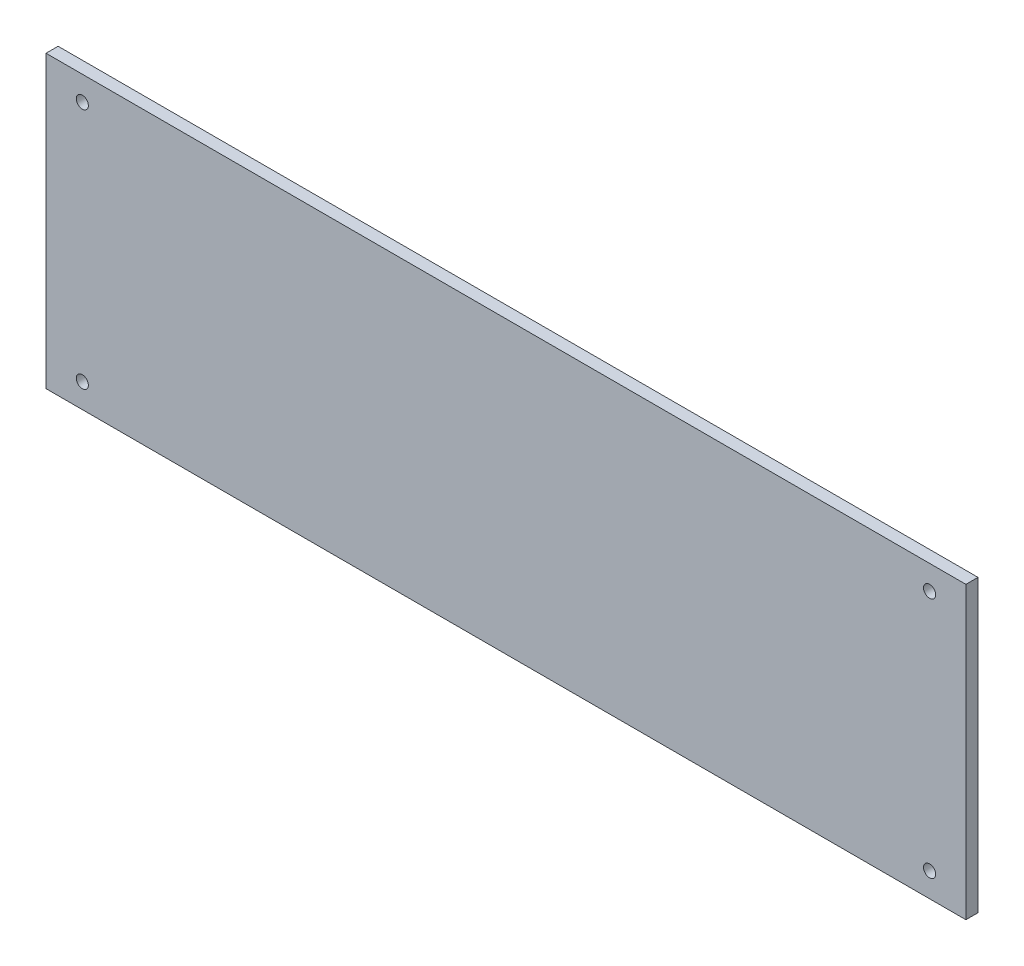
from build123d import *

# Parameters (mm, degrees)
SKETCH1_W                                  = 482.6
SKETCH1_H                                  = 152.4
BOSS_EXTRUDE1_DEPTH                        = 6.35
SKETCH2_R                                  = 3.175
CUT_EXTRUDE1_DEPTH                         = 254.125369136
MIRROR1_AT_THE_SECOND_PLANE_COPY_1_SKETC_R = 3.175
MIRROR1_AT_THE_SECOND_PLANE_COPY_1_DEPTH   = 254.125369136


with BuildPart() as part:
    # Sketch1 → Boss-Extrude1 (new body)
    with BuildSketch(Plane.XY):
        Rectangle(SKETCH1_W, SKETCH1_H)
    extrude(amount=BOSS_EXTRUDE1_DEPTH)

    # Sketch2 → Cut-Extrude1 (cut, through all)
    with BuildSketch(Plane.XY.offset(6.35)):
        with Locations((-222.25, -63.5)):
            Circle(SKETCH2_R)
    cut_extrude1 = extrude(amount=-CUT_EXTRUDE1_DEPTH, mode=Mode.SUBTRACT)

    # Mirror1: Cut-Extrude1 across plane
    add(cut_extrude1.mirror(Plane(origin=(0, 0, 0), x_dir=(0, 0, 1), z_dir=(1, 0, 0))), mode=Mode.SUBTRACT)

    # Mirror1 at the second plane: Cut-Extrude1 across plane
    add(cut_extrude1.mirror(Plane.ZX), mode=Mode.SUBTRACT)

    # Mirror1 at the second plane copy 1 sketc → Mirror1 at the second plane copy 1 (cut, through all)
    with BuildSketch(Plane(origin=(0, 0, 6.35), x_dir=(-1, 0, 0), z_dir=(0, 0, 1))):
        with Locations((-222.25, -63.5)):
            Circle(MIRROR1_AT_THE_SECOND_PLANE_COPY_1_SKETC_R)
    extrude(amount=-MIRROR1_AT_THE_SECOND_PLANE_COPY_1_DEPTH, mode=Mode.SUBTRACT)


solid = part.part
